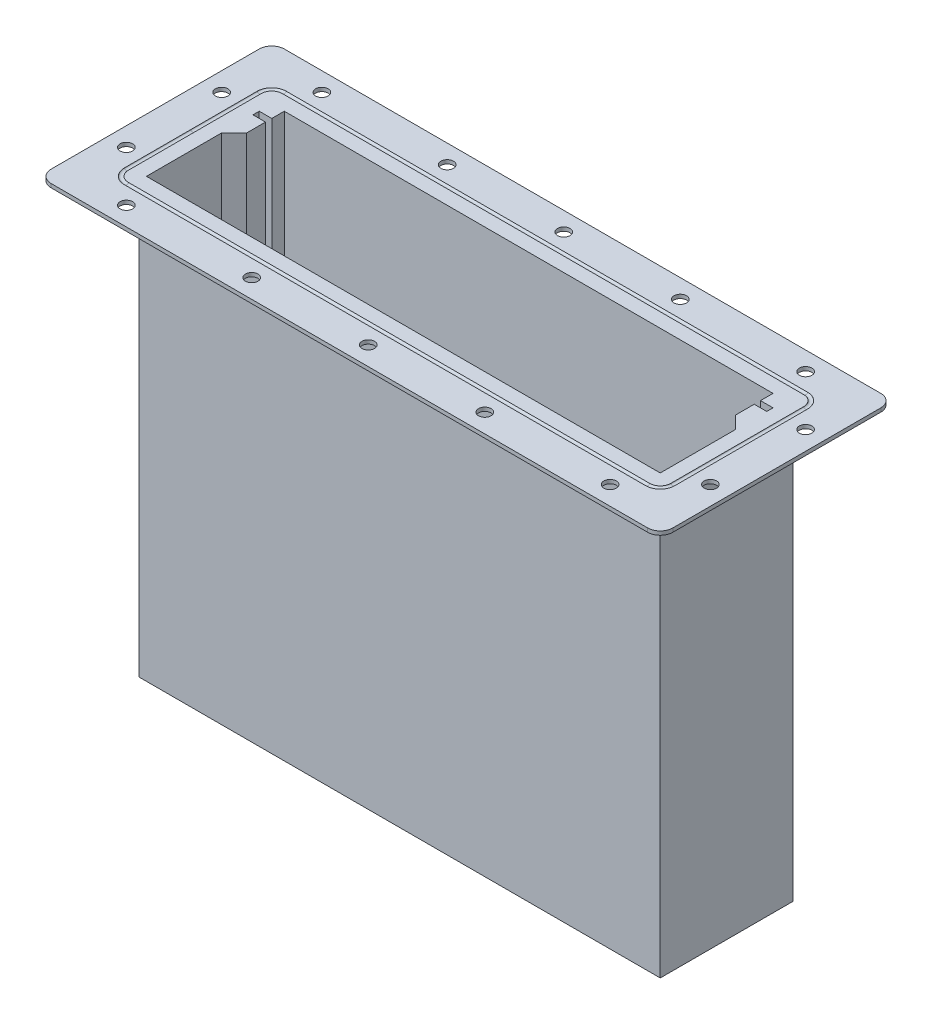
from build123d import *

# Parameters (mm, degrees)
BOSS_EXTRUDE1_DEPTH = 3
SKETCH1_3_W         = 416
SKETCH1_3_H         = 106
BOSS_EXTRUDE2_DEPTH = 343
SKETCH2_R           = 5
BOSS_EXTRUDE3_DEPTH = 3
SKETCH3_RX          = 1.6
SKETCH3_RY          = 1


with BuildPart() as part:
    # Sketch1 → Boss-Extrude1 (new body)
    with BuildSketch(Plane(origin=(0, 0, 0), x_dir=(1, 0, 0), z_dir=(0, 1, 0))):
        Polygon((-195, 40), (-205, 40), (-205, 35), (-195, 35), (-195, 20), (-205, 10), (-205, -50), (205, -50), (205, 10), (195, 20), (195, 35), (205, 35), (205, 40), (195, 40), (195, 50), (-195, 50), align=None)
    extrude(amount=BOSS_EXTRUDE1_DEPTH)

    # Sketch1<3> → Boss-Extrude2 (add)
    with BuildSketch(Plane(origin=(0, 0, 0), x_dir=(1, 0, 0), z_dir=(0, 1, 0))):
        Rectangle(SKETCH1_3_W, SKETCH1_3_H)
        Polygon((-195, 40), (-195, 50), (195, 50), (195, 40), (205, 40), (205, 35), (195, 35), (195, 20), (205, 10), (205, -50), (-205, -50), (-205, 10), (-195, 20), (-195, 35), (-205, 35), (-205, 40), align=None, mode=Mode.SUBTRACT)
    extrude(amount=BOSS_EXTRUDE2_DEPTH)

    # Sketch2 → Boss-Extrude3 (add)
    with BuildSketch(Plane(origin=(0, 343, 0), x_dir=(1, 0, 0), z_dir=(0, 1, 0))):
        with BuildLine():
            ThreePointArc((238, -93), (245.071067812, -90.071067812), (248, -83))
            Line((248, -83), (248, 83))
            ThreePointArc((248, 83), (245.071067812, 90.071067812), (238, 93))
            Line((238, 93), (-238, 93))
            ThreePointArc((-238, 93), (-245.071067812, 90.071067812), (-248, 83))
            Line((-248, 83), (-248, -83))
            ThreePointArc((-248, -83), (-245.071067812, -90.071067812), (-238, -93))
            Line((-238, -93), (238, -93))
        make_face()
        with Locations((-193, -78)):
            Circle(SKETCH2_R, mode=Mode.SUBTRACT)
        with Locations((-93, -78)):
            Circle(SKETCH2_R, mode=Mode.SUBTRACT)
        with Locations((-233, -38)):
            Circle(SKETCH2_R, mode=Mode.SUBTRACT)
        with Locations((0, -78)):
            Circle(SKETCH2_R, mode=Mode.SUBTRACT)
        with Locations((93, -78)):
            Circle(SKETCH2_R, mode=Mode.SUBTRACT)
        with Locations((193, -78)):
            Circle(SKETCH2_R, mode=Mode.SUBTRACT)
        with Locations((233, -38)):
            Circle(SKETCH2_R, mode=Mode.SUBTRACT)
        with Locations((-233, 38)):
            Circle(SKETCH2_R, mode=Mode.SUBTRACT)
        with Locations((-193, 78)):
            Circle(SKETCH2_R, mode=Mode.SUBTRACT)
        with Locations((-93, 78)):
            Circle(SKETCH2_R, mode=Mode.SUBTRACT)
        with Locations((233, 38)):
            Circle(SKETCH2_R, mode=Mode.SUBTRACT)
        with Locations((0, 78)):
            Circle(SKETCH2_R, mode=Mode.SUBTRACT)
        with Locations((93, 78)):
            Circle(SKETCH2_R, mode=Mode.SUBTRACT)
        with Locations((193, 78)):
            Circle(SKETCH2_R, mode=Mode.SUBTRACT)
        Polygon((-205, 40), (-195, 40), (-195, 50), (195, 50), (195, 40), (205, 40), (205, 35), (195, 35), (195, 20), (205, 10), (205, -50), (-205, -50), (-205, 10), (-195, 20), (-195, 35), (-205, 35), align=None, mode=Mode.SUBTRACT)
    extrude(amount=BOSS_EXTRUDE3_DEPTH)

    # Cut-Sweep2: sweep along a path in Sketch4
    with BuildLine(Plane(origin=(0, 346, 0), x_dir=(1, 0, 0), z_dir=(0, 1, 0))) as cut_sweep2_path:
        Line((-208, 63), (208, 63))
        ThreePointArc((208, 63), (215.071067812, 60.071067812), (218, 53))
        Line((218, 53), (218, -53))
        ThreePointArc((218, -53), (215.071067812, -60.071067812), (208, -63))
        Line((208, -63), (-208, -63))
        ThreePointArc((-208, -63), (-215.071067812, -60.071067812), (-218, -53))
        Line((-218, -53), (-218, 53))
        ThreePointArc((-218, 53), (-215.071067812, 60.071067812), (-208, 63))
    # Sketch3 → Cut-Sweep2 (sweep, cut)
    with BuildSketch(Plane.XY):
        with Locations((-218, 346)):
            Ellipse(SKETCH3_RX, SKETCH3_RY)
    sweep(path=cut_sweep2_path.line, mode=Mode.SUBTRACT)


solid = part.part
